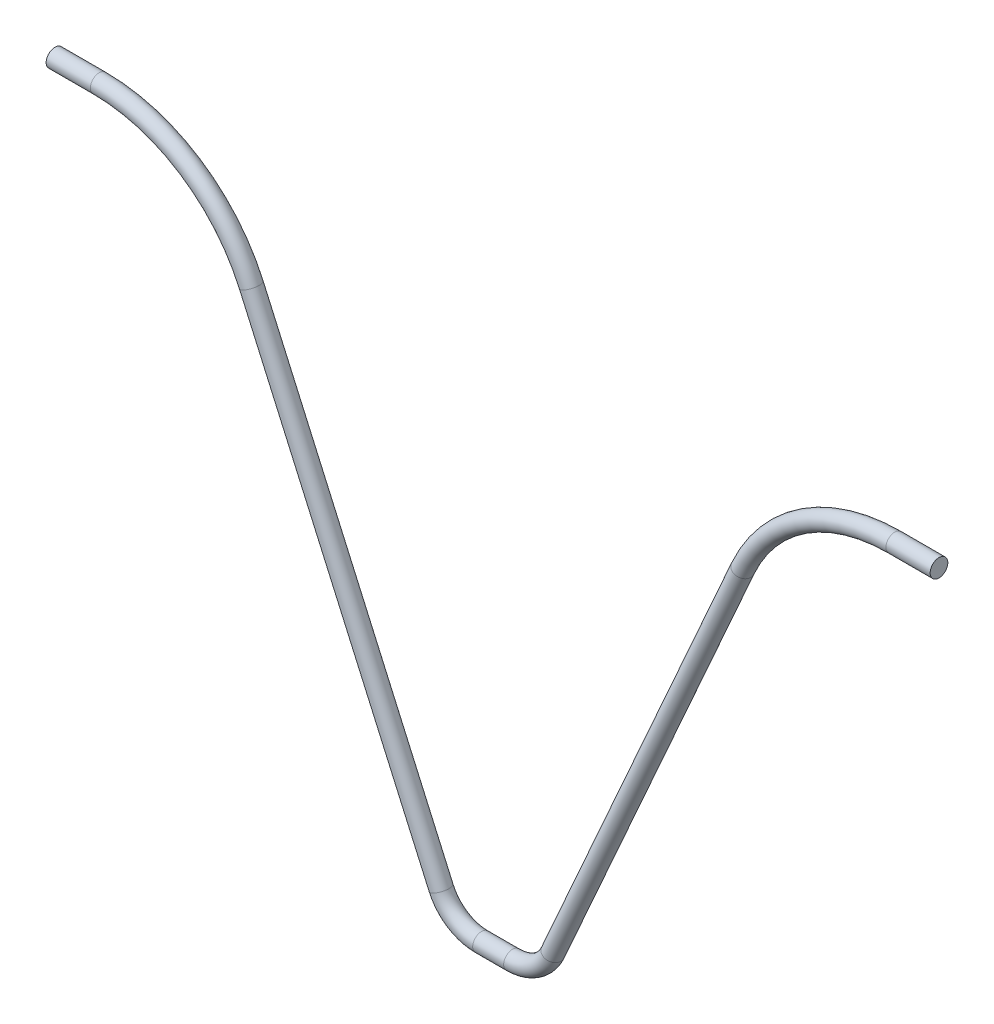
from build123d import *

# Parameters (mm, degrees)
SKETCH3_R = 20


with BuildPart() as part:
    # Sweep1: sweep along a path in Sketch1
    with BuildLine(Plane.XY) as sweep1_path:
        Line((1000, 840), (900, 840))
        ThreePointArc((900, 840), (694.823172742, 779.177367379), (555.941597945, 616.362038664))
        Line((555.941597945, 616.362038664), (126.388400703, -350.597539543))
        ThreePointArc((126.388400703, -350.597539543), (89.49883506, -393.84436163), (35, -410))
        Line((35, -410), (-35, -410))
        ThreePointArc((-35, -410), (-89.49883506, -393.84436163), (-126.388400703, -350.597539543))
        Line((-126.388400703, -350.597539543), (-555.941597945, 616.362038664))
        ThreePointArc((-555.941597945, 616.362038664), (-694.823172742, 779.177367379), (-900, 840))
        Line((-900, 840), (-1000, 840))
    # Sketch3 → Sweep1 (sweep)
    with BuildSketch(Plane(origin=(-1000, 0, 0), x_dir=(0, 0, -1), z_dir=(1, 0, 0))):
        with Locations((0, 840)):
            Circle(SKETCH3_R)
    sweep(path=sweep1_path.line)


solid = part.part
